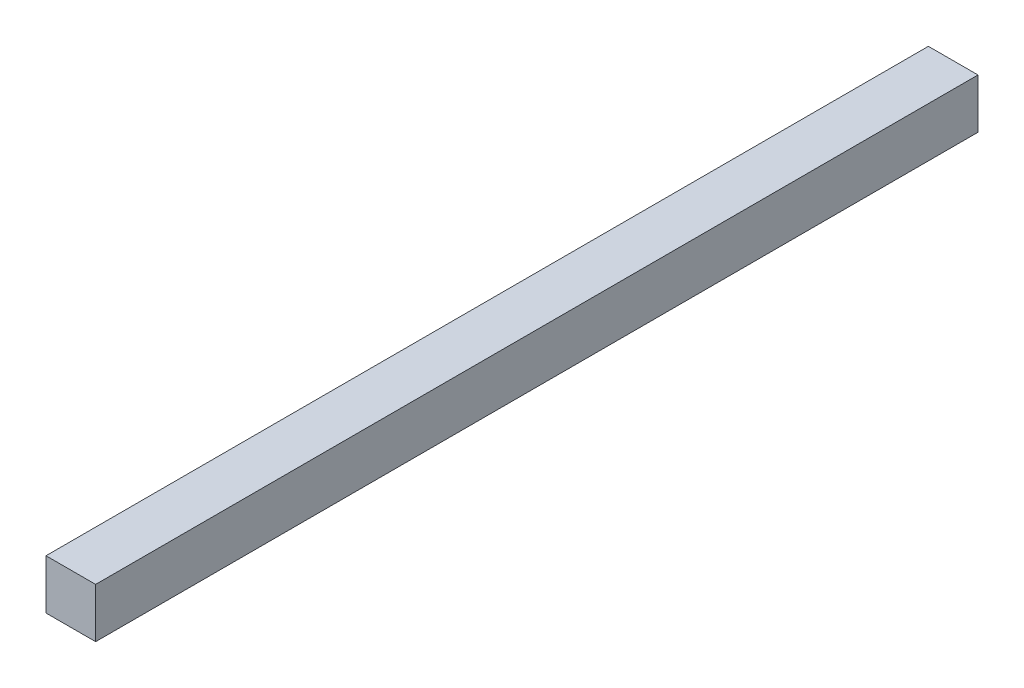
from build123d import *

# Parameters (mm, degrees)
SKETCH1_W           = 20
SKETCH1_H           = 20
BOSS_EXTRUDE1_DEPTH = 355.6


with BuildPart() as part:
    # Sketch1 → Boss-Extrude1 (new body)
    with BuildSketch(Plane.XY):
        Rectangle(SKETCH1_W, SKETCH1_H)
    extrude(amount=BOSS_EXTRUDE1_DEPTH)


solid = part.part
